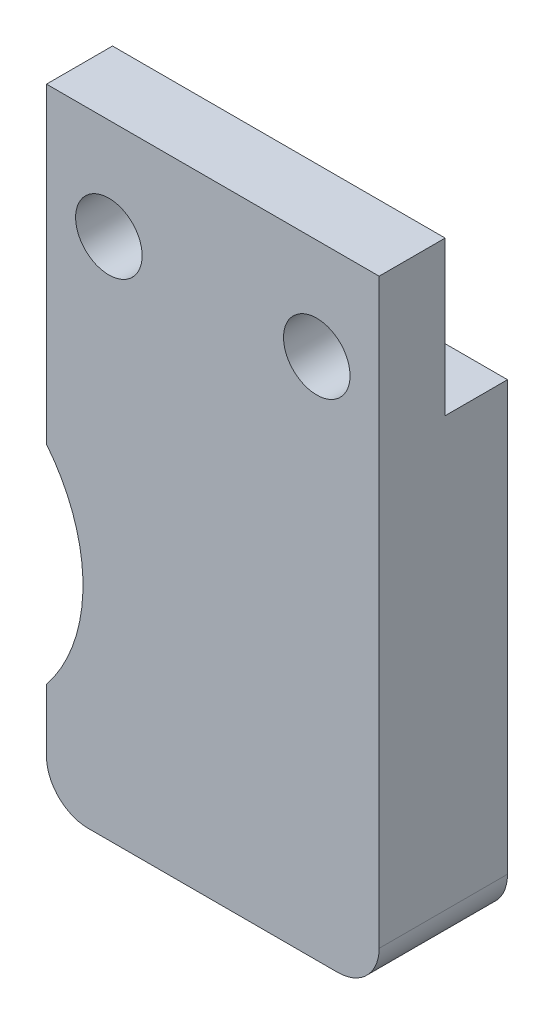
from build123d import *

# Parameters (mm, degrees)
SKETCH1_W           = 16
SKETCH1_H           = 30
SKETCH1_R           = 1.6
BOSS_EXTRUDE1_DEPTH = 3.175
SKETCH3_W           = 16
SKETCH3_H           = 22.6
BOSS_EXTRUDE2_DEPTH = 3
FILLET1_R           = 2
CUT_EXTRUDE1_DEPTH  = 52.011083355


with BuildPart() as part:
    # Sketch1 → Boss-Extrude1 (new body)
    with BuildSketch(Plane.XY):
        with Locations((0, -35)):
            Rectangle(SKETCH1_W, SKETCH1_H)
        with Locations((5, -24.85)):
            Circle(SKETCH1_R, mode=Mode.SUBTRACT)
        with Locations((-5, -24.85)):
            Circle(SKETCH1_R, mode=Mode.SUBTRACT)
    extrude(amount=BOSS_EXTRUDE1_DEPTH)

    # Sketch3 → Boss-Extrude2 (add)
    with BuildSketch(Plane(origin=(0, 0, 0), x_dir=(-1, 0, 0), z_dir=(0, 0, -1))):
        with Locations((0, -38.7)):
            Rectangle(SKETCH3_W, SKETCH3_H)
    extrude(amount=BOSS_EXTRUDE2_DEPTH)

    # Fillet1
    fillet1_edges = [part.edges().sort_by_distance(p)[0] for p in [
        (8, -50, 0.0875),
        (-8, -50, 0.0875),
    ]]
    fillet(fillet1_edges, radius=FILLET1_R)

    # Sketch4 → Cut-Extrude1 (cut, through all)
    with BuildSketch(Plane.XY.offset(3.175)):
        with BuildLine():
            Line((-8, -45), (-8, -35))
            ThreePointArc((-8, -35), (-6.244997998, -40), (-8, -45))
        make_face()
    extrude(amount=-CUT_EXTRUDE1_DEPTH, mode=Mode.SUBTRACT)


solid = part.part
